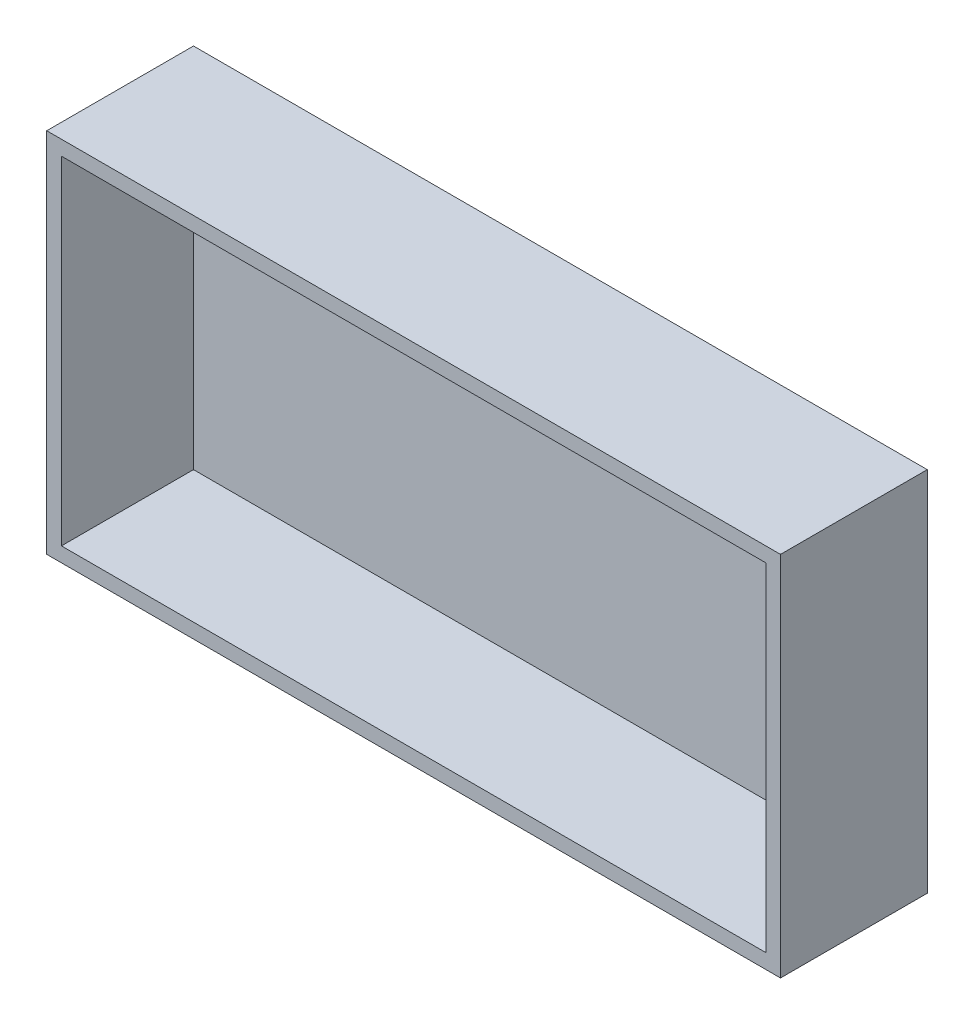
from build123d import *

# Parameters (mm, degrees)
SKETCH1_W           = 100
SKETCH1_H           = 50
BOSS_EXTRUDE1_DEPTH = 20
SHELL1_T            = -2


with BuildPart() as part:
    # Sketch1 → Boss-Extrude1 (new body)
    with BuildSketch(Plane.XY):
        with Locations((53, 30)):
            Rectangle(SKETCH1_W, SKETCH1_H)
    extrude(amount=BOSS_EXTRUDE1_DEPTH)

    # Shell1
    shell1_openings = [part.faces().sort_by_distance(p)[0] for p in [
        (53, 30, 20),
    ]]
    offset(amount=SHELL1_T, openings=shell1_openings, kind=Kind.INTERSECTION)


solid = part.part
